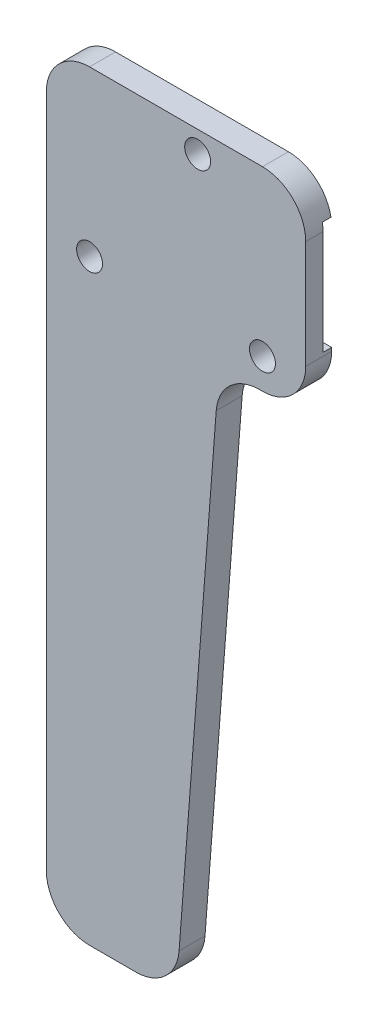
from build123d import *

# Parameters (mm, degrees)
CROQUIS1_R              = 1.5
SALIENTE_EXTRUIR1_DEPTH = 3
CROQUIS2_W              = 30
CROQUIS2_H              = 13
CORTAR_EXTRUIR2_DEPTH   = 1


with BuildPart() as part:
    # Croquis1 → Saliente-Extruir1 (new body)
    with BuildSketch(Plane.XY):
        with BuildLine():
            Line((0, -5), (0, -83))
            ThreePointArc((0, -83), (1.464466094, -86.535533906), (5, -88))
            Line((5, -88), (10.367132634, -88))
            ThreePointArc((10.367132634, -88), (13.765451273, -86.667619177), (15.352628079, -83.380572171))
            Line((15.352628079, -83.380572171), (19.647371921, -27.119427829))
            ThreePointArc((19.647371921, -27.119427829), (21.234548727, -23.832380823), (24.632867366, -22.5))
            Line((24.632867366, -22.5), (25, -22.5))
            ThreePointArc((25, -22.5), (28.535533906, -21.035533906), (30, -17.5))
            Line((30, -17.5), (30, -5))
            ThreePointArc((30, -5), (28.535533906, -1.464466094), (25, 0))
            Line((25, 0), (5, 0))
            ThreePointArc((5, 0), (1.464466094, -1.464466094), (0, -5))
        make_face()
        with Locations((17.5, -2.5)):
            Circle(CROQUIS1_R, mode=Mode.SUBTRACT)
        with Locations((5, -19)):
            Circle(CROQUIS1_R, mode=Mode.SUBTRACT)
        with Locations((25, -19)):
            Circle(CROQUIS1_R, mode=Mode.SUBTRACT)
    extrude(amount=-SALIENTE_EXTRUIR1_DEPTH)

    # Croquis2 → Cortar-Extruir2 (cut)
    with BuildSketch(Plane(origin=(0, 0, -3), x_dir=(-1, 0, 0), z_dir=(0, 0, -1))):
        with Locations((-15, -10.6)):
            Rectangle(CROQUIS2_W, CROQUIS2_H)
    extrude(amount=-CORTAR_EXTRUIR2_DEPTH, mode=Mode.SUBTRACT)


solid = part.part
